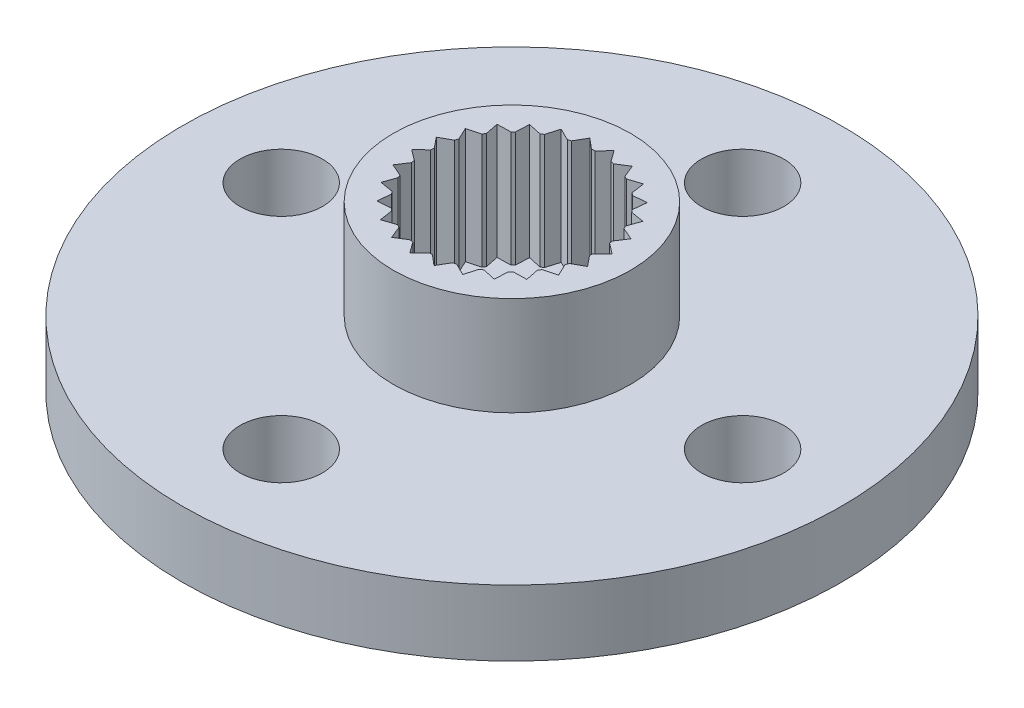
from build123d import *

# Parameters (mm, degrees)
M3_TAPPED_HOLE1_D  = 2.5
CUT_EXTRUDE1_DEPTH = 3.5


with BuildPart() as part:
    # Sketch1 → Revolve1 (revolve)
    with BuildSketch(Plane.XY, mode=Mode.PRIVATE) as revolve1_sk:
        Polygon((2.345142076, 2), (1.5, 2), (1.5, 0), (10, 0), (10, 2), (3.6, 2), (3.6, 5), (2.345142076, 5), align=None)
    revolve(revolve1_sk.sketch.rotate(Axis((0, 6.795271061, 0), (0, -1, 0)), 90), axis=Axis((0, 6.795271061, 0), (0, -1, 0)))

    # M3 Tapped Hole1 (through all)
    with Locations(Plane(origin=(0, 2, 0), x_dir=(1, 0, 0), z_dir=(0, 1, 0))):
        with Locations((-7, 0), (0, 7), (7, 0), (0, -7)):
            Hole(M3_TAPPED_HOLE1_D / 2)

    # Sketch5 → Cut-Extrude1 (cut)
    with BuildSketch(Plane(origin=(0, 5, 0), x_dir=(1, 0, 0), z_dir=(0, 1, 0))):
        Polygon((-1.365561553, 2.212519298), (-1.76486465, 2.301141622), (-1.782802347, 1.892515731), (-1.855371341, 1.821427239), (-2.264280127, 1.811914873), (-2.18390601, 1.410870135), (-2.237353692, 1.324480448), (-2.632103873, 1.217386217), (-2.458088994, 0.847229896), (-2.489309178, 0.750559669), (-2.846959309, 0.552107499), (-2.589416781, 0.234351734), (-2.596595063, 0.133019089), (-2.896359819, -0.1452577), (-2.570257076, -0.392146098), (-2.552976281, -0.492252076), (-2.777434424, -0.834181049), (-2.401723373, -0.995853825), (-2.360987798, -1.08891534), (-2.497094635, -1.474624828), (-2.093610237, -1.541686147), (-2.031787285, -1.622294803), (-2.071632783, -2.029368772), (-1.663824084, -1.997921274), (-1.584506681, -2.061392388), (-1.525775164, -2.466173179), (-1.137342523, -2.338044479), (-1.045140308, -2.380689341), (-0.891245038, -2.759652566), (-0.544762749, -2.542289037), (-0.445034179, -2.561629282), (-0.20491899, -2.892750976), (0.079476656, -2.598784997), (0.180935719, -2.593696641), (0.493316205, -2.857733214), (0.699097167, -2.504249019), (0.79639029, -2.475027779), (1.162881655, -2.656634385), (1.278088691, -2.264175191), (1.365561553, -2.212519298), (1.76486465, -2.301141622), (1.782802347, -1.892515731), (1.855371341, -1.821427239), (2.264280127, -1.811914873), (2.18390601, -1.410870135), (2.237353692, -1.324480448), (2.632103873, -1.217386217), (2.458088994, -0.847229896), (2.489309178, -0.750559669), (2.846959309, -0.552107499), (2.589416781, -0.234351734), (2.596595063, -0.133019089), (2.896359819, 0.1452577), (2.570257076, 0.392146098), (2.552976281, 0.492252076), (2.777434424, 0.834181049), (2.401723373, 0.995853825), (2.360987798, 1.08891534), (2.497094635, 1.474624828), (2.093610237, 1.541686147), (2.031787285, 1.622294803), (2.071632783, 2.029368772), (1.663824084, 1.997921274), (1.584506681, 2.061392388), (1.525775164, 2.466173179), (1.137342523, 2.338044479), (1.045140308, 2.380689341), (0.891245038, 2.759652566), (0.544762749, 2.542289037), (0.445034179, 2.561629282), (0.20491899, 2.892750976), (-0.079476656, 2.598784997), (-0.180935719, 2.593696641), (-0.493316205, 2.857733214), (-0.699097167, 2.504249019), (-0.79639029, 2.475027779), (-1.162881655, 2.656634385), (-1.278088691, 2.264175191), align=None)
    extrude(amount=-CUT_EXTRUDE1_DEPTH, mode=Mode.SUBTRACT)


solid = part.part
